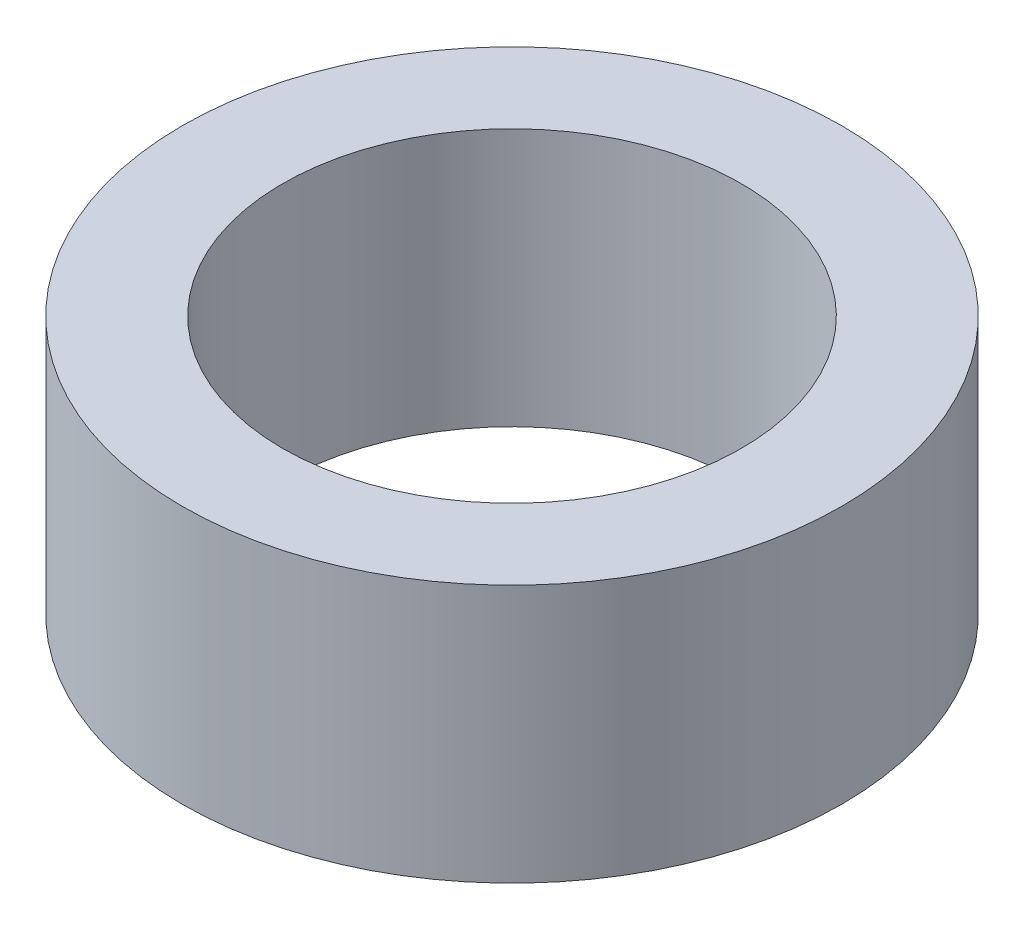
from build123d import *

# Parameters (mm, degrees)
SKETCH_1_R      = 2.3
SKETCH_1_R_2    = 1.6
EXTRUDE_1_DEPTH = 1.8


with BuildPart() as part:
    # 草图1 → 凸台-拉伸1 (new body)
    with BuildSketch(Plane(origin=(0, 0, 0), x_dir=(1, 0, 0), z_dir=(0, 1, 0))):
        with Locations(Location((0, 0, 0), (0, 0, 270))):
            Circle(SKETCH_1_R)
        with Locations(Location((0, 0, 0), (0, 0, 270))):
            Circle(SKETCH_1_R_2, mode=Mode.SUBTRACT)
    extrude(amount=EXTRUDE_1_DEPTH)


solid = part.part
